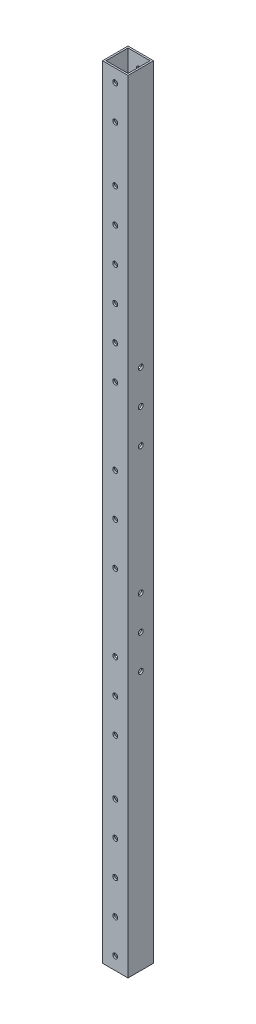
from build123d import *

# Parameters (mm, degrees)
SKETCH_1_W          = 15
SKETCH_1_H          = 15
SKETCH_1_W_2        = 13
SKETCH_1_H_2        = 13
EXTRUDE_1_DEPTH     = 460
SKETCH_2_R          = 1.45
CUT_EXTRUDE_1_DEPTH = 461.305605006
SKETCH_3_R          = 1.45
CUT_EXTRUDE_2_DEPTH = 461.305605006


with BuildPart() as part:
    # 草图1 → 拉伸-薄壁1 (new body)
    with BuildSketch(Plane(origin=(0, 0, 0), x_dir=(1, 0, 0), z_dir=(0, 1, 0))):
        Rectangle(SKETCH_1_W, SKETCH_1_H)
        Rectangle(SKETCH_1_W_2, SKETCH_1_H_2, mode=Mode.SUBTRACT)
    extrude(amount=EXTRUDE_1_DEPTH)

    # 草图2 → 切除-拉伸1 (cut, through all)
    with BuildSketch(Plane.XY.offset(7.5)):
        with Locations((0, 7.5)):
            Circle(SKETCH_2_R)
        with Locations((0, 27.5)):
            Circle(SKETCH_2_R)
        with Locations(Location((0, 432.5, 0), (0, 0, 180))):
            Circle(SKETCH_2_R)
        with Locations(Location((0, 452.5, 0), (0, 0, 180))):
            Circle(SKETCH_2_R)
        with Locations((0, 140)):
            Circle(SKETCH_2_R)
        with Locations((0, 160)):
            Circle(SKETCH_2_R)
        with Locations((0, 120)):
            Circle(SKETCH_2_R)
        with Locations(Location((0, 340, 0), (0, 0, 180))):
            Circle(SKETCH_2_R)
        with Locations(Location((0, 300, 0), (0, 0, 180))):
            Circle(SKETCH_2_R)
        with Locations(Location((0, 320, 0), (0, 0, 180))):
            Circle(SKETCH_2_R)
        with Locations((0, 230)):
            Circle(SKETCH_2_R)
        with Locations((0, 255)):
            Circle(SKETCH_2_R)
        with Locations((0, 205)):
            Circle(SKETCH_2_R)
        with Locations((0, 47.5)):
            Circle(SKETCH_2_R)
        with Locations((0, 67.5)):
            Circle(SKETCH_2_R)
        with Locations((0, 87.5)):
            Circle(SKETCH_2_R)
        with Locations((0, 360)):
            Circle(SKETCH_2_R)
        with Locations((0, 380)):
            Circle(SKETCH_2_R)
        with Locations((0, 400)):
            Circle(SKETCH_2_R)
    extrude(amount=-CUT_EXTRUDE_1_DEPTH, mode=Mode.SUBTRACT)

    # 草图3 → 切除-拉伸2 (cut, through all)
    with BuildSketch(Plane(origin=(7.5, 0, 0), x_dir=(0, 0, -1), z_dir=(1, 0, 0))):
        with Locations((0, 152.5)):
            Circle(SKETCH_3_R)
        with Locations((0, 172.5)):
            Circle(SKETCH_3_R)
        with Locations((0, 287.5)):
            Circle(SKETCH_3_R)
        with Locations((0, 307.5)):
            Circle(SKETCH_3_R)
        with Locations((0, 192.5)):
            Circle(SKETCH_3_R)
        with Locations((0, 267.5)):
            Circle(SKETCH_3_R)
    extrude(amount=-CUT_EXTRUDE_2_DEPTH, mode=Mode.SUBTRACT)


solid = part.part
